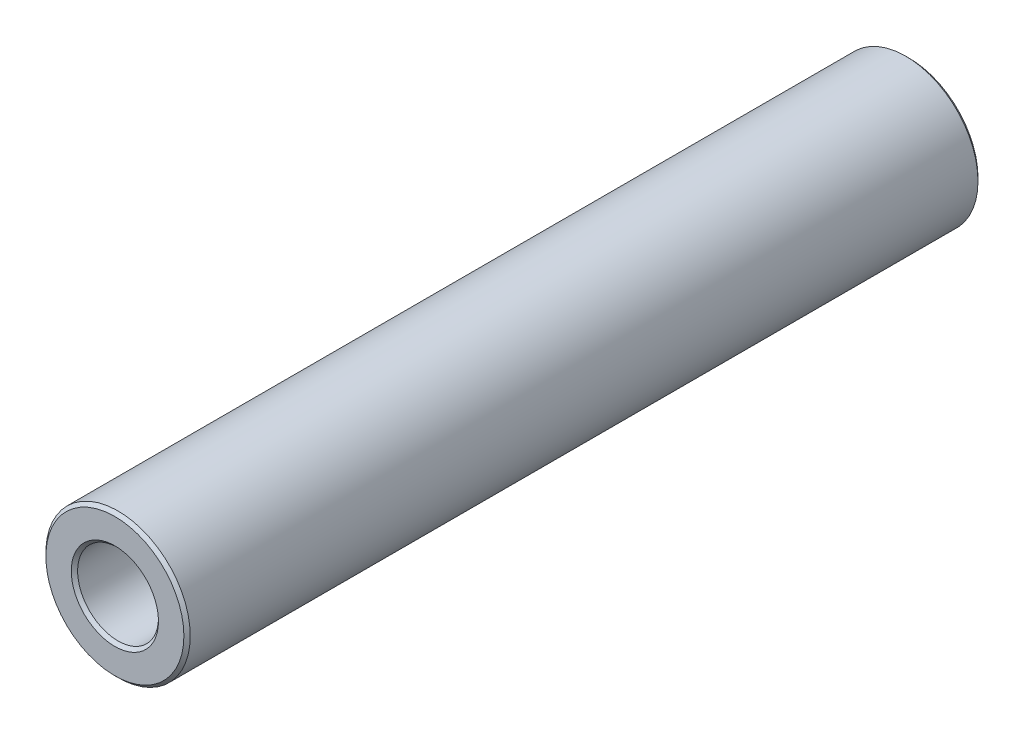
from build123d import *

# Parameters (mm, degrees)
BOSS_EXTRUDE1_DEPTH      = 17.4625
BOSS_EXTRUDE1_DEPTH_BACK = 17.4625
SKETCH3_R                = 3.175
SKETCH3_R_2              = 1.778
CHAMFER1_SIZE            = 0.1397


with BuildPart() as part:
    # Sketch3 → Boss-Extrude1 (new, two sides: drawn at the far end of the back side and taken through both)
    with BuildSketch(Plane.XY.offset(-BOSS_EXTRUDE1_DEPTH_BACK)):
        Circle(SKETCH3_R)
        Circle(SKETCH3_R_2, mode=Mode.SUBTRACT)
    extrude(amount=BOSS_EXTRUDE1_DEPTH + BOSS_EXTRUDE1_DEPTH_BACK)

    # Chamfer1
    chamfer1_edges = [part.edges().sort_by_distance(p)[0] for p in [
        (-3.175, 0, -17.4625),
        (-1.778, 0, -17.4625),
        (-3.175, 0, 17.4625),
        (-1.778, 0, 17.4625),
    ]]
    chamfer(chamfer1_edges, length=CHAMFER1_SIZE)


solid = part.part
